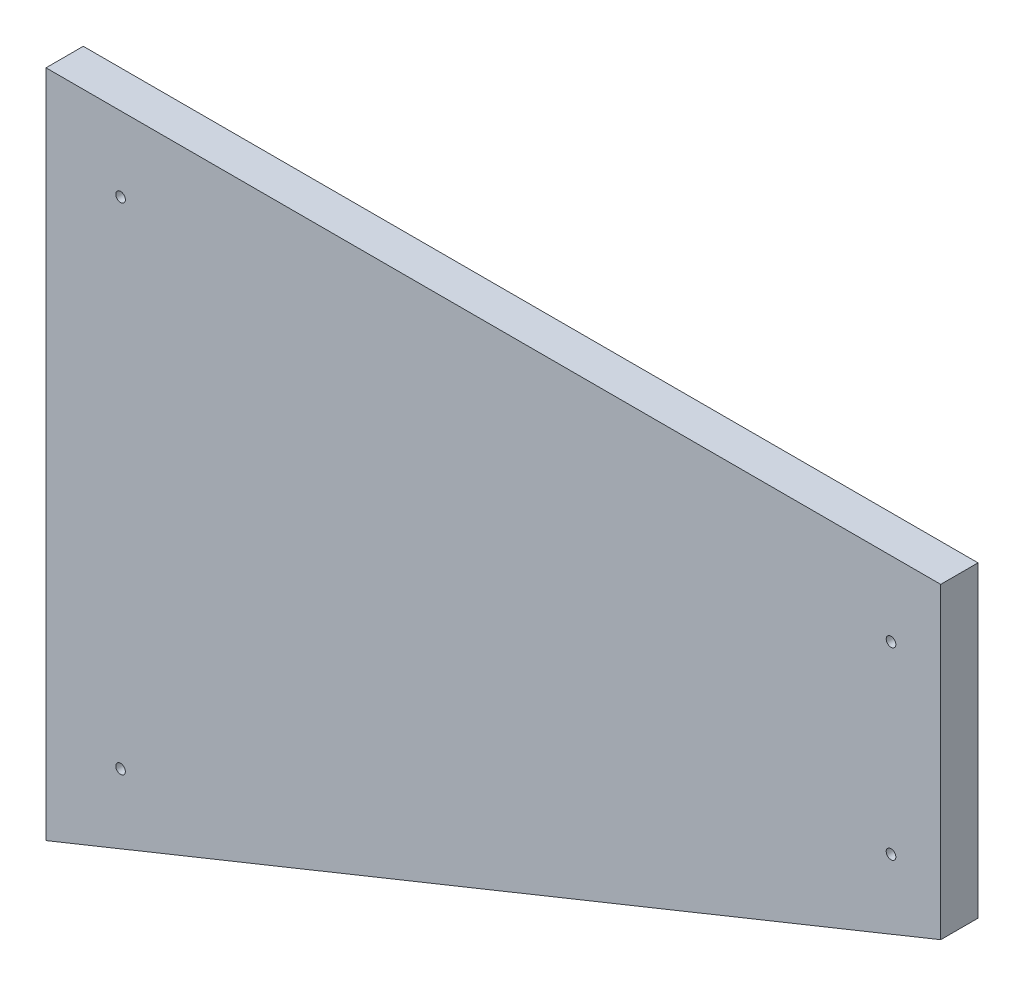
from build123d import *

# Parameters (mm, degrees)
BOSS_EXTRUDE1_DEPTH                               = 19.05
CSK_FOR_8_FLAT_HEAD_MACHINE_SCREW_100_D           = 4.9149
CSK_FOR_8_FLAT_HEAD_MACHINE_SCREW_100_CSINK_D     = 8.4328
CSK_FOR_8_FLAT_HEAD_MACHINE_SCREW_100_CSINK_ANGLE = 100


with BuildPart() as part:
    # Sketch1 → Boss-Extrude1 (new body)
    with BuildSketch(Plane.XY):
        Polygon((2683.51, 6983.72999014), (2683.51, 6641.741886848), (3140.71, 6826.4626773), (3140.71, 6983.72999014), align=None)
    extrude(amount=BOSS_EXTRUDE1_DEPTH)

    # CSK for #8 Flat Head Machine Screw (100)1 (through all)
    with Locations(Plane.YX):
        with Locations((6692.541891629, 2721.610000001), (6945.629994921, 2721.610000001), (6945.629994921, 3115.310000001), (6851.60701674, 3115.310000001)):
            CounterSinkHole(CSK_FOR_8_FLAT_HEAD_MACHINE_SCREW_100_D / 2, CSK_FOR_8_FLAT_HEAD_MACHINE_SCREW_100_CSINK_D / 2, counter_sink_angle=CSK_FOR_8_FLAT_HEAD_MACHINE_SCREW_100_CSINK_ANGLE)


solid = part.part
